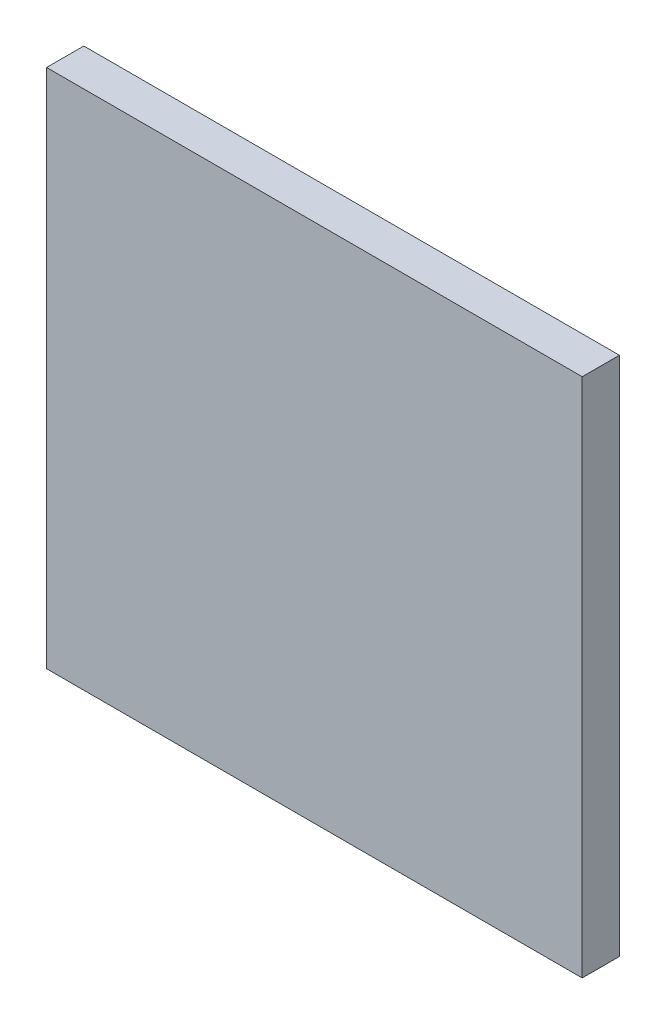
from build123d import *

# Parameters (mm, degrees)
ESQUISSE1_W      = 72
ESQUISSE1_H      = 70
EXTRUSION1_DEPTH = 5


with BuildPart() as part:
    # Esquisse1 → Extrusion1 (new body)
    with BuildSketch(Plane.XY):
        with Locations((-0.9395338, 23.374615385)):
            Rectangle(ESQUISSE1_W, ESQUISSE1_H)
    extrude(amount=EXTRUSION1_DEPTH)


solid = part.part
